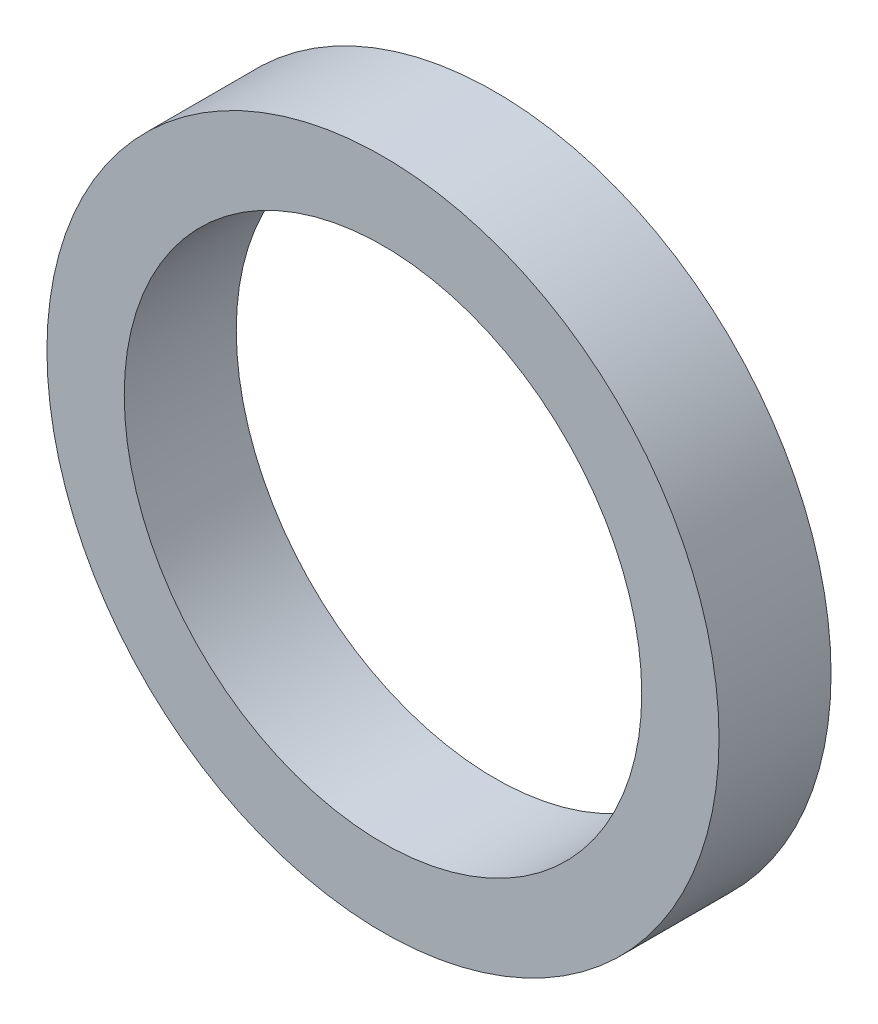
from build123d import *

# Parameters (mm, degrees)
SKETCH_1_R      = 30
SKETCH_1_R_2    = 23.1
EXTRUDE_1_DEPTH = 10


with BuildPart() as part:
    # 草图1 → 凸台-拉伸1 (new body)
    with BuildSketch(Plane.XY):
        Circle(SKETCH_1_R)
        Circle(SKETCH_1_R_2, mode=Mode.SUBTRACT)
    extrude(amount=EXTRUDE_1_DEPTH)


solid = part.part
